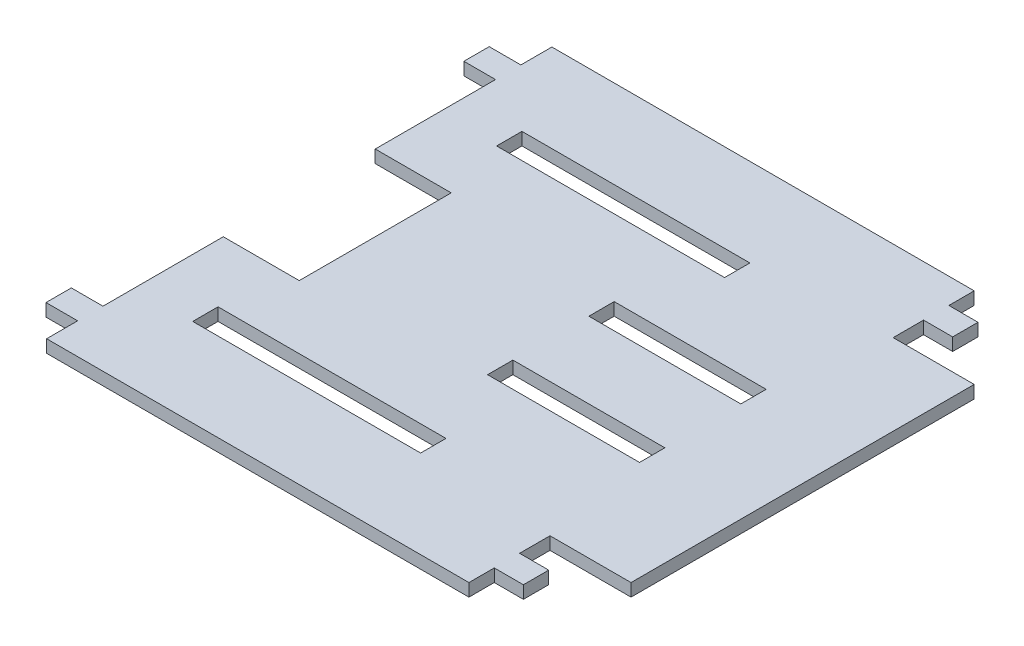
from build123d import *

# Parameters (mm, degrees)
CROQUIS2_W              = 60
CROQUIS2_H              = 10
CROQUIS2_W_2            = 90
SALIENTE_EXTRUIR1_DEPTH = 5


with BuildPart() as part:
    # Croquis2 → Saliente-Extruir1 (new body)
    with BuildSketch(Plane(origin=(0, 0, 0), x_dir=(1, 0, 0), z_dir=(0, 1, 0))):
        Polygon((119.248757736, -67.751242264), (119.248757736, 67.751242264), (87.248757736, 67.751242264), (87.248757736, 79.751242264), (98.748757736, 79.751242264), (98.748757736, 89.751242264), (87.248757736, 89.751242264), (87.248757736, 99.751242264), (-79.502303886, 99.751242264), (-79.502303886, 87.5), (-92.002303886, 87.5), (-92.002303886, 77.5), (-79.502303886, 77.5), (-79.502303886, 30), (-49.502303886, 30), (-49.502303886, -30), (-79.502303886, -30), (-79.502303886, -77.5), (-92.002303886, -77.5), (-92.002303886, -87.5), (-79.502303886, -87.5), (-79.502303886, -99.751242264), (87.248757736, -99.751242264), (87.248757736, -89.751242264), (98.748757736, -89.751242264), (98.748757736, -79.751242264), (87.248757736, -79.751242264), (87.248757736, -67.751242264), align=None)
        with Locations((49.851646293, 20)):
            Rectangle(CROQUIS2_W, CROQUIS2_H, mode=Mode.SUBTRACT)
        with Locations((49.851646293, -20)):
            Rectangle(CROQUIS2_W, CROQUIS2_H, mode=Mode.SUBTRACT)
        with Locations((-11.573483533, -60)):
            Rectangle(CROQUIS2_W_2, CROQUIS2_H, mode=Mode.SUBTRACT)
        with Locations((-11.573483533, 60)):
            Rectangle(CROQUIS2_W_2, CROQUIS2_H, mode=Mode.SUBTRACT)
    extrude(amount=SALIENTE_EXTRUIR1_DEPTH)


solid = part.part
